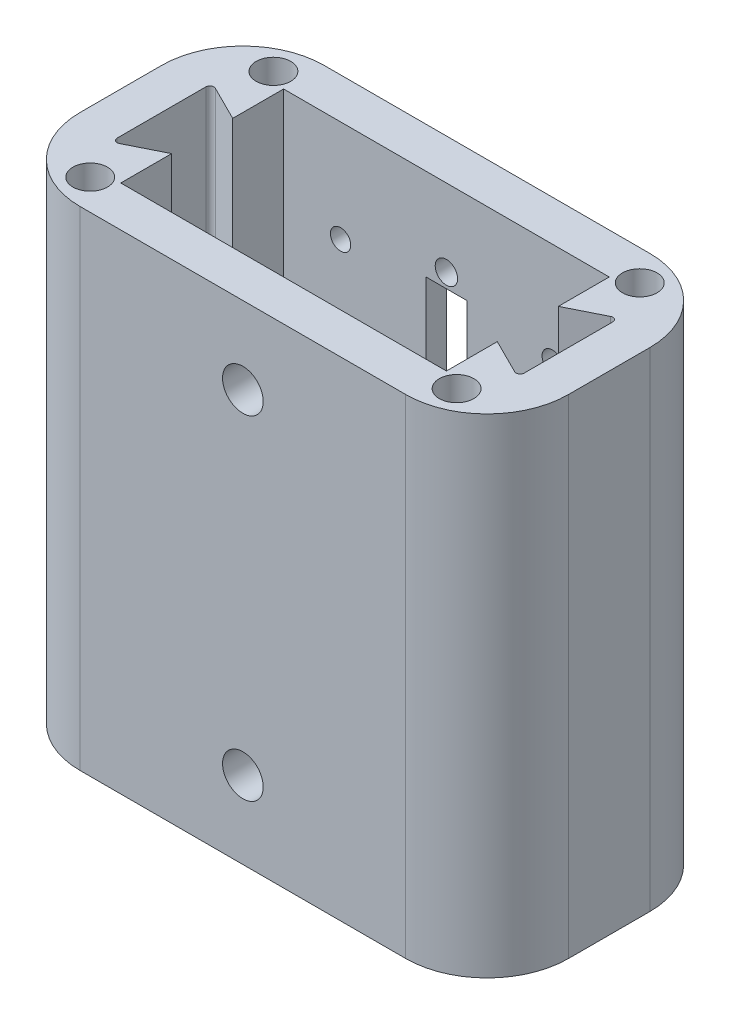
from build123d import *

# Parameters (mm, degrees)
SKETCH1_W           = 60
SKETCH1_H           = 30
SKETCH1_W_2         = 40
SKETCH1_H_2         = 20
BOSS_EXTRUDE1_DEPTH = 5
SKETCH2_W           = 60
SKETCH2_H           = 30
BOSS_EXTRUDE2_DEPTH = 55
SKETCH4_R           = 1.375
SKETCH4_W           = 5
SKETCH4_H           = 37.5
CUT_EXTRUDE1_DEPTH  = 5
SKETCH5_W           = 15
SKETCH5_H           = 47.5
CUT_EXTRUDE2_DEPTH  = 2.5
FILLET1_R           = 10
SKETCH6_R           = 2.125
CUT_EXTRUDE3_DEPTH  = 5
SKETCH7_R           = 2.5
CUT_EXTRUDE4_DEPTH  = 5
SKETCH8_R           = 1.25
CUT_EXTRUDE5_DEPTH  = 5


with BuildPart() as part:
    # Sketch1 → Boss-Extrude1 (new body)
    with BuildSketch(Plane(origin=(0, 0, 0), x_dir=(1, 0, 0), z_dir=(0, 1, 0))):
        Rectangle(SKETCH1_W, SKETCH1_H)
        Rectangle(SKETCH1_W_2, SKETCH1_H_2, mode=Mode.SUBTRACT)
    extrude(amount=BOSS_EXTRUDE1_DEPTH)

    # Sketch2 → Boss-Extrude2 (add)
    with BuildSketch(Plane(origin=(0, 5, 0), x_dir=(1, 0, 0), z_dir=(0, 1, 0))):
        Rectangle(SKETCH2_W, SKETCH2_H)
        with BuildLine():
            Line((20, 10), (20, 3.75))
            Line((20, 3.75), (24.276393202, 5.888196601))
            ThreePointArc((24.276393202, 5.888196601), (24.762865556, 5.86630841), (25, 5.440983006))
            Line((25, 5.440983006), (25, -5.440983006))
            ThreePointArc((25, -5.440983006), (24.762865556, -5.86630841), (24.276393202, -5.888196601))
            Line((24.276393202, -5.888196601), (20, -3.75))
            Line((20, -3.75), (20, -10))
            Line((20, -10), (-20, -10))
            Line((-20, -10), (-20, -3.75))
            Line((-20, -3.75), (-24.276393202, -5.888196601))
            ThreePointArc((-24.276393202, -5.888196601), (-24.762865556, -5.86630841), (-25, -5.440983006))
            Line((-25, -5.440983006), (-25, 5.440983006))
            ThreePointArc((-25, 5.440983006), (-24.762865556, 5.86630841), (-24.276393202, 5.888196601))
            Line((-24.276393202, 5.888196601), (-20, 3.75))
            Line((-20, 3.75), (-20, 10))
            Line((-20, 10), (20, 10))
        make_face(mode=Mode.SUBTRACT)
    extrude(amount=BOSS_EXTRUDE2_DEPTH)

    # Sketch4 → Cut-Extrude1 (cut)
    with BuildSketch(Plane(origin=(-36.213203436, 0, -15), x_dir=(1, 0, 0), z_dir=(0, 0, 1))):
        with Locations(Location((36.213203436, 50.5, 0), (0, 0, 180))):
            Circle(SKETCH4_R)
        with Locations(Location((36.213203436, 9.5, 0), (0, 0, 180))):
            Circle(SKETCH4_R)
        with Locations((36.213203436, 30)):
            Rectangle(SKETCH4_W, SKETCH4_H)
    extrude(amount=CUT_EXTRUDE1_DEPTH, mode=Mode.SUBTRACT)

    # Sketch5 → Cut-Extrude2 (cut)
    with BuildSketch(Plane(origin=(0, 0, -15), x_dir=(-1, 0, 0), z_dir=(0, 0, -1))):
        with Locations((0, 30)):
            Rectangle(SKETCH5_W, SKETCH5_H)
    extrude(amount=-CUT_EXTRUDE2_DEPTH, mode=Mode.SUBTRACT)

    # Fillet1
    fillet1_edges = [part.edges().sort_by_distance(p)[0] for p in [
        (30, 30, 15),
        (-30, 30, 15),
        (-30, 30, -15),
        (30, 30, -15),
    ]]
    fillet(fillet1_edges, radius=FILLET1_R)

    # Sketch6 → Cut-Extrude3 (cut)
    with BuildSketch(Plane(origin=(0, 60, 0), x_dir=(1, 0, 0), z_dir=(0, 1, 0))):
        with Locations(Location((-22.5, 11.25, 0), (0, 0, 270))):
            Circle(SKETCH6_R)
        with Locations(Location((22.5, 11.25, 0), (0, 0, 270))):
            Circle(SKETCH6_R)
        with Locations(Location((-22.5, -11.25, 0), (0, 0, 270))):
            Circle(SKETCH6_R)
        with Locations(Location((22.5, -11.25, 0), (0, 0, 270))):
            Circle(SKETCH6_R)
    extrude(amount=-CUT_EXTRUDE3_DEPTH, mode=Mode.SUBTRACT)

    # Sketch7 → Cut-Extrude4 (cut)
    with BuildSketch(Plane.XY.offset(15)):
        with Locations((0, 50.5)):
            Circle(SKETCH7_R)
        with Locations((0, 9.5)):
            Circle(SKETCH7_R)
    extrude(amount=-CUT_EXTRUDE4_DEPTH, mode=Mode.SUBTRACT)

    # Sketch8 → Cut-Extrude5 (cut)
    with BuildSketch(Plane(origin=(0, 0, -15), x_dir=(-1, 0, 0), z_dir=(0, 0, -1))):
        with Locations((-13, 47.5)):
            Circle(SKETCH8_R)
        with Locations((13, 47.5)):
            Circle(SKETCH8_R)
        with Locations((-13, 12.5)):
            Circle(SKETCH8_R)
        with Locations((13, 12.5)):
            Circle(SKETCH8_R)
    extrude(amount=-CUT_EXTRUDE5_DEPTH, mode=Mode.SUBTRACT)


solid = part.part
